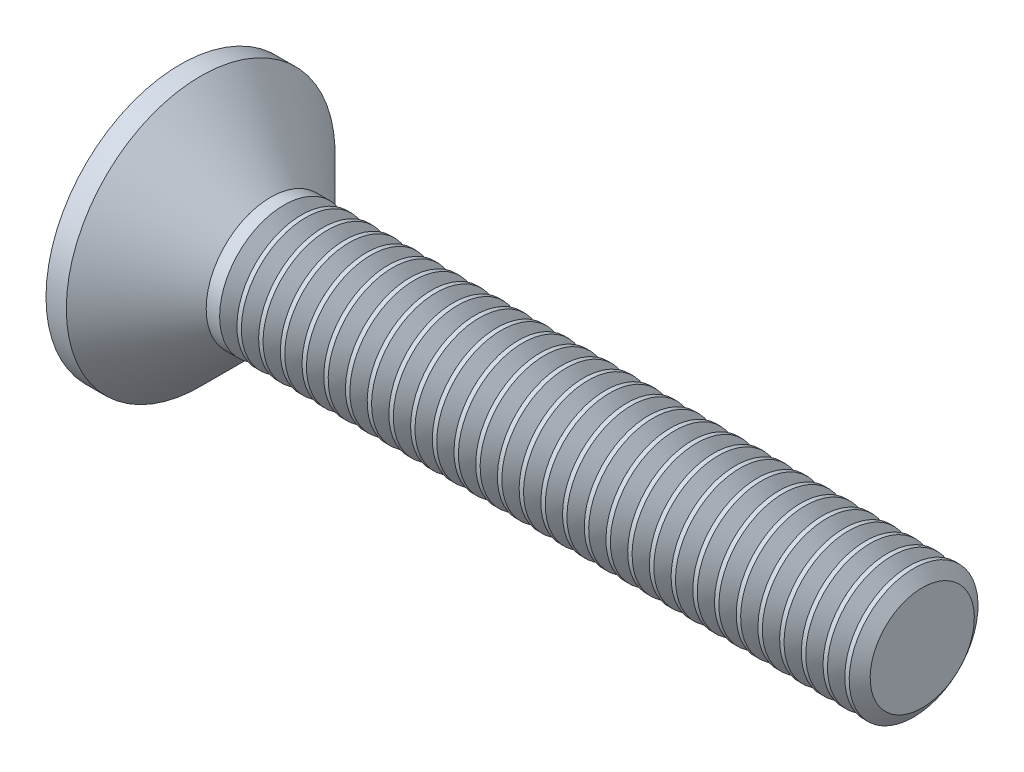
from build123d import *

# Parameters (mm, degrees)
CIRPATTERN1_COUNT = 2
CIRPATTERN1_ANGLE = 90
THDSCHPAT_COUNT   = 30
THDSCHPAT_PITCH   = 0.589655172


with BuildPart() as part:
    # BodySke → Base-Revolve (revolve)
    with BuildSketch(Plane.XY, mode=Mode.PRIVATE) as base_revolve_sk:
        with BuildLine():
            Line((0, 0), (20.780340915, 0))
            Line((20.780340915, 0), (20.780340915, 1.75))
            Line((20.780340915, 1.75), (3.080340915, 1.75))
            Line((3.080340915, 1.75), (1.180340915, 3.65))
            Line((1.180340915, 3.65), (0.629289216, 3.65))
            ThreePointArc((0.629289216, 3.65), (0.158474328, 1.851925006), (0, 0))
        make_face()
    revolve(base_revolve_sk.sketch.rotate(Axis((-15.875, 0, 0), (1, 0, 0)), 90), axis=Axis((-15.875, 0, 0), (1, 0, 0)))

    # Sketch3 → Cross section 0
    with BuildSketch(Plane(origin=(0, 0, 0), x_dir=(0, 0, -1), z_dir=(1, 0, 0))):
        with BuildLine():
            Line((0.47, -2.19), (-0.47, -2.19))
            Line((-0.47, -2.19), (-0.47, 2.19))
            Line((-0.47, 2.19), (0.47, 2.19))
            Line((0.47, 2.19), (0.47, -2.19))
        make_face()
    # Sketch4 → Cross section 1
    with BuildSketch(Plane(origin=(2.48, 0, 0), x_dir=(0, 0, -1), z_dir=(1, 0, 0))):
        with BuildLine():
            Line((0.235, -0.235), (-0.235, -0.235))
            Line((-0.235, -0.235), (-0.235, 0.235))
            Line((-0.235, 0.235), (0.235, 0.235))
            Line((0.235, 0.235), (0.235, -0.235))
        make_face()
    cross = loft(mode=Mode.SUBTRACT)

    # CirPattern1: Cross ×2 about axis
    cirpattern1_axis = Axis((0, 0, 0), (1, 0, 0))
    for i in range(1, CIRPATTERN1_COUNT):
        add(cross.rotate(cirpattern1_axis, i * CIRPATTERN1_ANGLE / (CIRPATTERN1_COUNT - 1)), mode=Mode.SUBTRACT)

    # ThdSchSke → ThreadSchematic (revolve, cut)
    with BuildSketch(Plane.XY, mode=Mode.PRIVATE) as threadschematic_sk:
        Polygon((3.680340915, -1.4145), (3.445421286, -1.75), (3.445421286, -2.1875), (3.915260544, -2.1875), (3.915260544, -1.75), align=None)
    threadschematic = revolve(threadschematic_sk.sketch.rotate(Axis((-3.175, 0, 0), (1, 0, 0)), 347.48563201), axis=Axis((-3.175, 0, 0), (1, 0, 0)), mode=Mode.SUBTRACT)

    # ThdSchPat: ThreadSchematic ×30
    with Locations(*[(i * THDSCHPAT_PITCH, 0, 0) for i in range(1, THDSCHPAT_COUNT)]):
        add(threadschematic, mode=Mode.SUBTRACT)


solid = part.part
